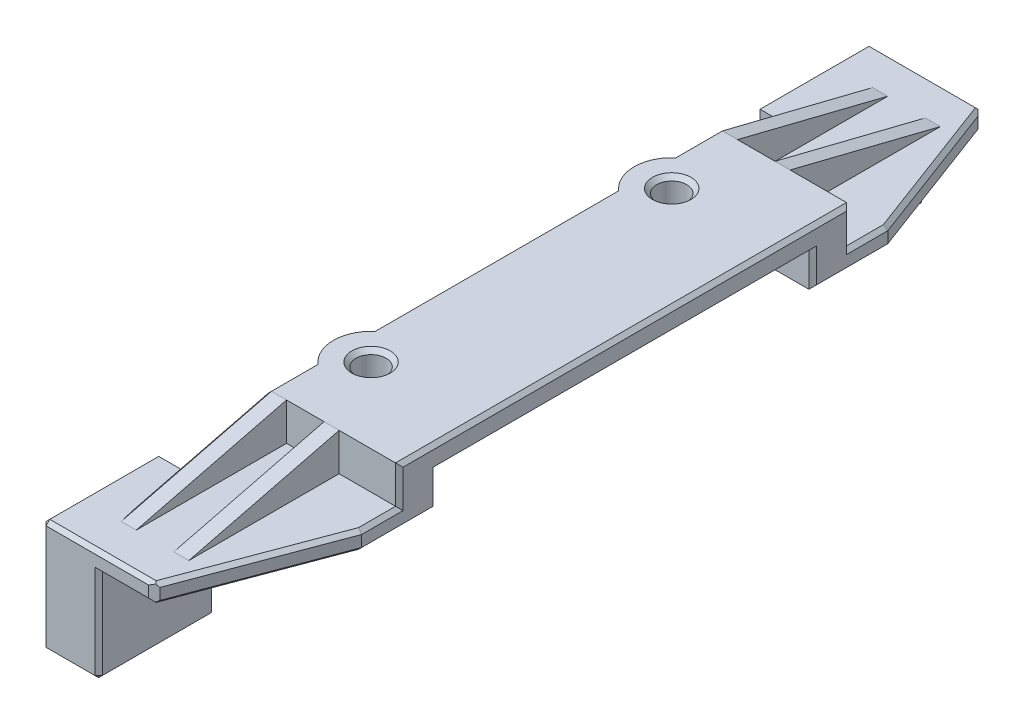
from build123d import *
from OCP.BRepFilletAPI import BRepFilletAPI_MakeChamfer

# Parameters (mm, degrees)
SKETCH_1_W          = 7
SKETCH_1_H          = 44
EXTRUDE_1_DEPTH     = 3
CUT_EXTRUDE_1_DEPTH = 23.477766793
CUT_EXTRUDE_2_DEPTH = 24.280893454
RIB_4_REACH         = 25.281
SKETCH_4_WALL_W     = 56.807998158
SKETCH_4_WALL_H     = 1
RIB_5_REACH         = 24.561
SKETCH_5_WALL_W     = 55.368267942
SKETCH_5_WALL_H     = 0.8
SKETCH_10_W         = 20
SKETCH_10_H         = 3.6
CUT_EXTRUDE_3_DEPTH = 24.280893454
EXTRUDE_2_DEPTH     = 3
EXTRUDE_START       = -1
SKETCH_9_W          = 6
SKETCH_9_H          = 6
EXTRUDE_3_DEPTH     = 3
CHAMFER_1_SIZE      = 0.2
CHAMFER_1_SIZE2     = 0.34176015
CHAMFER_2_SIZE      = 0.2
CHAMFER_3_SIZE      = 0.2


with BuildPart() as part:
    # 草图1 → 凸台-拉伸1 (new body)
    with BuildSketch(Plane(origin=(0, 0, 0), x_dir=(1, 0, 0), z_dir=(0, 1, 0))):
        Rectangle(SKETCH_1_W, SKETCH_1_H)
    extrude(amount=EXTRUDE_1_DEPTH)

    # 草图2 → 切除-拉伸1 (cut, through all)
    with BuildSketch(Plane(origin=(0, 3, 0), x_dir=(1, 0, 0), z_dir=(0, 1, 0))):
        Polygon((3.5, 22), (0.5, 22), (3.5, 14), align=None)
        Polygon((3.5, -22), (0.5, -22), (3.5, -14), align=None)
    extrude(amount=-CUT_EXTRUDE_1_DEPTH, mode=Mode.SUBTRACT)

    # 草图3 → 切除-拉伸2 (cut, through all)
    with BuildSketch(Plane(origin=(3.5, 0, 0), x_dir=(0, 0, -1), z_dir=(1, 0, 0))):
        Polygon((-14, 2.6), (-14, 3), (-22, 3), (-22, 1), align=None)
        Polygon((-14, 1), (-14, 2.6), (-22, 1), align=None)
        Polygon((-12, 1), (-12, 3), (-14, 2.6), (-14, 1), align=None)
        Polygon((-14, 2.6), (-12, 3), (-14, 3), align=None)
        Polygon((14, 2.6), (12, 3), (12, 1), (14, 1), align=None)
        Polygon((22, 1), (14, 2.6), (14, 1), align=None)
        Polygon((22, 3), (14, 3), (14, 2.6), (22, 1), align=None)
        Polygon((14, 3), (12, 3), (14, 2.6), align=None)
    extrude(amount=-CUT_EXTRUDE_2_DEPTH, mode=Mode.SUBTRACT)

    # 草图4 wall → 筋4 (add, up to next)
    with BuildSketch(Plane(origin=(-3.5, 2, 16), x_dir=(0, -0.242535625036, 0.970142500145), z_dir=(0, 0.970142500145, 0.242535625036)), mode=Mode.PRIVATE) as rib_4_sk1:
        with Locations((0, 0.5)):
            Rectangle(SKETCH_4_WALL_W, SKETCH_4_WALL_H)
    rib_4_tool1 = extrude(rib_4_sk1.sketch, amount=-RIB_4_REACH, mode=Mode.PRIVATE) - part.part
    rib_4 = rib_4_tool1.solids().sort_by_distance((-3.5, 2, 16))[0]
    add(rib_4)

    # 草图5 wall → 筋5 (add, up to next)
    with BuildSketch(Plane(origin=(-0.5, 2, 16), x_dir=(0, -0.242535625036, 0.970142500145), z_dir=(0, 0.970142500145, 0.242535625036)), mode=Mode.PRIVATE) as rib_5_sk1:
        with Locations((0, 0.4)):
            Rectangle(SKETCH_5_WALL_W, SKETCH_5_WALL_H)
    rib_5_tool1 = extrude(rib_5_sk1.sketch, amount=-RIB_5_REACH, mode=Mode.PRIVATE) - part.part
    rib_5 = rib_5_tool1.solids().sort_by_distance((-0.5, 2, 16))[0]
    add(rib_5)

    # 草图10 → 切除-拉伸3 (cut, through all)
    with BuildSketch(Plane.ZY.offset(3.5)):
        Rectangle(SKETCH_10_W, SKETCH_10_H)
    extrude(amount=-CUT_EXTRUDE_3_DEPTH, mode=Mode.SUBTRACT)

    # 草图6 → 凸台-拉伸2 (add)
    with BuildSketch(Plane(origin=(0, 3, 0), x_dir=(1, 0, 0), z_dir=(0, 1, 0))):
        with BuildLine():
            Line((0, -6), (-2, -6))
            ThreePointArc((-2, -6), (-4, -8), (-2, -10))
            Line((-2, -10), (0, -10))
            Line((0, -10), (0, -6))
        make_face()
    extrude_2 = extrude(amount=-EXTRUDE_2_DEPTH)

    # 草图8 → M2 螺纹孔1 (revolve, cut)
    with BuildSketch(Plane(origin=(-2, 3, 8), x_dir=(0, 0, 1), z_dir=(1, 0, 0))):
        Polygon((0, 0), (0, 6.480688495), (0.8, 6), (0.8, 0.225), (1.025, 0), align=None)
    hole_wizard_m2_1 = revolve(axis=Axis((-2, 9.35, 8), (0, -1, 0)), mode=Mode.SUBTRACT)

    # 草图9 → 凸台-拉伸3 (add)
    with BuildSketch(Plane.ZY.offset(3.5).offset(EXTRUDE_START)):
        with Locations((19, -2)):
            Rectangle(SKETCH_9_W, SKETCH_9_H)
    extrude_3 = extrude(amount=EXTRUDE_3_DEPTH)

    # 镜向1: 筋4, 筋5, 凸台-拉伸2, M2 螺纹孔1, 凸台-拉伸3 across plane
    add(rib_4.mirror(Plane.XY))
    add(rib_5.mirror(Plane.XY))
    add(extrude_2.mirror(Plane.XY))
    add(hole_wizard_m2_1.mirror(Plane.XY), mode=Mode.SUBTRACT)
    add(extrude_3.mirror(Plane.XY))

    # 倒角1: one chamfer whose edges measure the first distance from different faces: ONE call of the kernel's chamfer builder (chamfer() names one face for all edges)
    chamfer_1_edges_1 = [part.edges().sort_by_distance(p)[0] for p in [
        (0.5, 0.5, -22),
    ]]
    chamfer_1_side_1 = [part.faces().sort_by_distance(p)[0] for p in [
        (-3.571428571, -1.642857143, -22),
    ]]
    chamfer_1_edges_2 = [part.edges().sort_by_distance(p)[0] for p in [
        (-1, 0, 22),
        (-2.5, -2.5, 22),
        (-4, -5, 22),
        (-2.5, -5, 19),
        (-4, -5, 16),
        (-5.5, -2, 22),
        (-5.5, 1, 19),
        (-5.5, -2, 16),
        (-5.5, -5, 19),
        (-1, 0, -22),
        (-4, -5, -22),
        (-5.5, -2, -22),
        (-5.5, -2, -16),
        (-5.5, 1, -19),
        (-4, -5, -16),
        (-5.5, -5, -19),
        (-2.5, -2.5, -22),
        (-2.5, -5, -19),
        (-2.5, 1, 22),
        (-2.5, 1, -22),
    ]]
    chamfer_1_edges_3 = [part.edges().sort_by_distance(p)[0] for p in [
        (0.5, 0.5, 22),
    ]]
    chamfer_1_side_3 = [part.faces().sort_by_distance(p)[0] for p in [
        (2, 0.5, 18),
    ]]
    chamfer_1 = BRepFilletAPI_MakeChamfer(part.part.solid().wrapped)
    for e in chamfer_1_edges_1:
        chamfer_1.Add(CHAMFER_1_SIZE, CHAMFER_1_SIZE2, e.wrapped, chamfer_1_side_1[0].wrapped)  # the first distance lies on this face
    for e in chamfer_1_edges_2:
        chamfer_1.Add(CHAMFER_1_SIZE, e.wrapped)
    for e in chamfer_1_edges_3:
        chamfer_1.Add(CHAMFER_1_SIZE, CHAMFER_1_SIZE2, e.wrapped, chamfer_1_side_3[0].wrapped)  # the first distance lies on this face
    add(Compound.cast(chamfer_1.Shape()), mode=Mode.REPLACE)

    # 倒角2
    chamfer_2_edges = [part.edges().sort_by_distance(p)[0] for p in [
        (2.06, 0, -17.84),
        (2.06, 1, -17.84),
        (3.5, 0, -12),
        (3.5, 0.9, -10),
        (3.5, 1.8, 0),
        (3.5, 0.9, 10),
        (3.5, 0, 12),
        (2.0375, 0, 17.9),
        (3.5, 1, -13),
        (3.5, 2, -12),
        (3.5, 3, 0),
        (3.5, 2, 12),
        (3.5, 1, 13),
        (2.0375, 1, 17.9),
    ]]
    chamfer(chamfer_2_edges, length=CHAMFER_2_SIZE)

    # 倒角3
    chamfer_3_edges = [part.edges().sort_by_distance(p)[0] for p in [
        (-3.5, 0, 13),
        (-3.5, 1.8, 0),
        (-3.5, 3, 10.661437828),
        (-3.5, 2, -16),
        (-3.5, 3, 0),
        (-3.5, 0, -13),
        (-3.5, 3, -10.661437828),
        (-3.5, 2, 16),
    ]]
    chamfer(chamfer_3_edges, length=CHAMFER_3_SIZE)


solid = part.part
